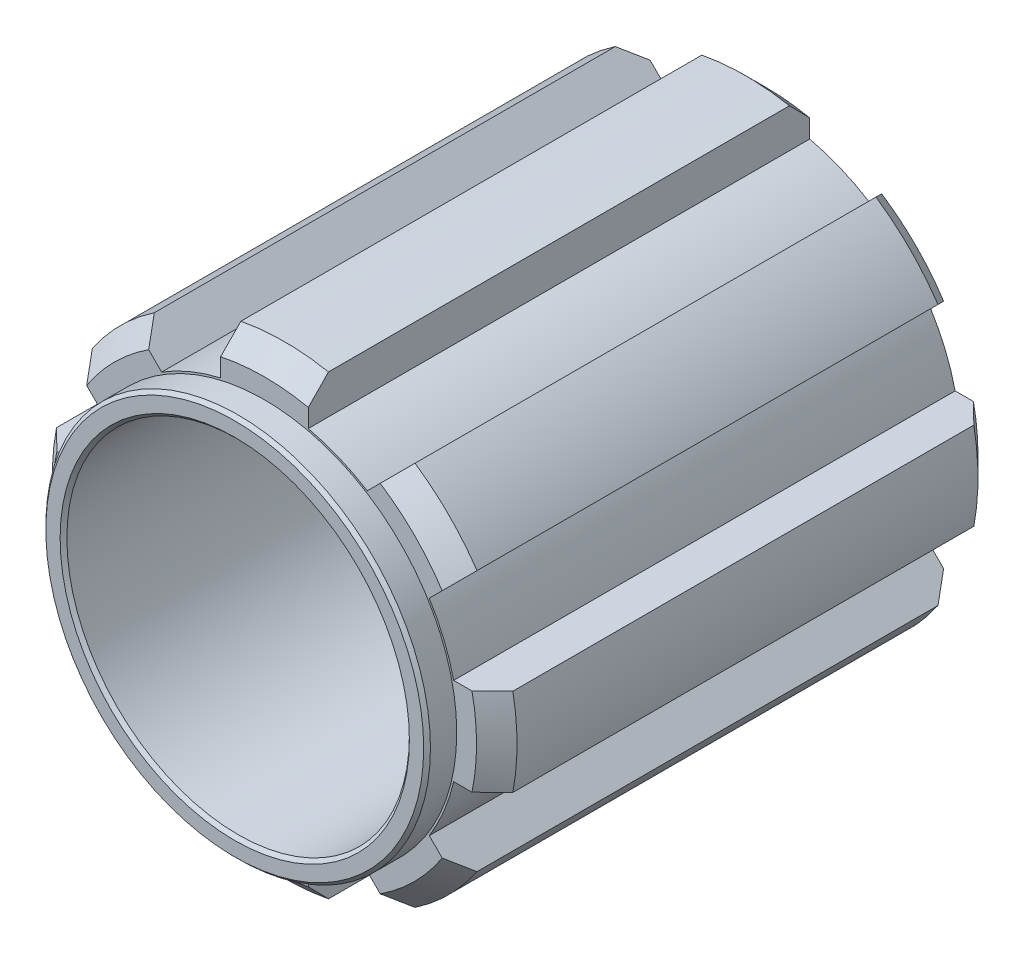
from build123d import *

# Parameters (mm, degrees)
SKETCH1_R           = 14.4
SKETCH1_R_2         = 12.695
BOSS_EXTRUDE1_DEPTH = 39.37
BOSS_EXTRUDE2_START = -39.37
BOSS_EXTRUDE2_DEPTH = 39.37
CIRPATTERN1_COUNT   = 8
SKETCH3_OUTSIDE_W   = 48.978
SKETCH3_OUTSIDE_H   = 48.978
SKETCH3_OUTSIDE_R   = 14.255
CUT_EXTRUDE1_DEPTH  = 2.2
CHAMFER2_SIZE       = 0.25


with BuildPart() as part:
    # Sketch1 → Boss-Extrude1 (new body)
    with BuildSketch(Plane.XY):
        Circle(SKETCH1_R)
        Circle(SKETCH1_R_2, mode=Mode.SUBTRACT)
    extrude(amount=BOSS_EXTRUDE1_DEPTH)

    # Sketch2 → Boss-Extrude2 (add)
    with BuildSketch(Plane.XY.offset(39.37).offset(BOSS_EXTRUDE2_START)):
        with BuildLine():
            Line((-3.25, 16.915617784), (-3.25, 14.028453229))
            ThreePointArc((-3.25, 14.028453229), (0, 14.4), (3.25, 14.028453229))
            Line((3.25, 14.028453229), (3.25, 16.915617784))
            ThreePointArc((3.25, 16.915617784), (0, 17.225), (-3.25, 16.915617784))
        make_face()
    boss_extrude2 = extrude(amount=BOSS_EXTRUDE2_DEPTH)

    # CirPattern1: Boss-Extrude2 ×8 about axis
    cirpattern1_axis = Axis((0, 0, 0), (0, 0, 1))
    for i in range(1, CIRPATTERN1_COUNT):
        add(boss_extrude2.rotate(cirpattern1_axis, i * 360 / CIRPATTERN1_COUNT))

    # Sketch3 outside → Cut-Extrude1 (cut)
    with BuildSketch(Plane.XY.offset(39.37)):
        Rectangle(SKETCH3_OUTSIDE_W, SKETCH3_OUTSIDE_H)
        Circle(SKETCH3_OUTSIDE_R, mode=Mode.SUBTRACT)
    extrude(amount=-CUT_EXTRUDE1_DEPTH, mode=Mode.SUBTRACT)

    # Sketch5 → Cut-Revolve1 (revolve, cut)
    with BuildSketch(Plane(origin=(0, 0, 0), x_dir=(0, 0, -1), z_dir=(1, 0, 0))):
        Polygon((-35.67, 17.225), (-37.17, 15.725), (-37.17, 17.225), align=None)
        Polygon((0, 17.225), (-1.5, 17.225), (0, 15.725), align=None)
    revolve(axis=Axis((0, 0, 0), (0, 0, -1)), mode=Mode.SUBTRACT)

    # Sketch8 → Cut-Revolve2 (revolve, cut)
    with BuildSketch(Plane(origin=(0, 0, 0), x_dir=(1, 0, 0), z_dir=(0, 1, 0))):
        Polygon((-8.195, -5), (-8.195, 0), (-12.695, 0), (-12.695, -0.5), align=None)
        Polygon((-12.695, -0.5), (-12.695, 0), (-13.195, 0), align=None)
    revolve(axis=Axis((0, 0, 0), (0, 0, -1)), mode=Mode.SUBTRACT)

    # Chamfer2
    chamfer2_edges = [part.edges().sort_by_distance(p)[0] for p in [
        (-14.255, 0, 39.37),
        (-12.695, 0, 39.37),
    ]]
    chamfer(chamfer2_edges, length=CHAMFER2_SIZE)


solid = part.part
